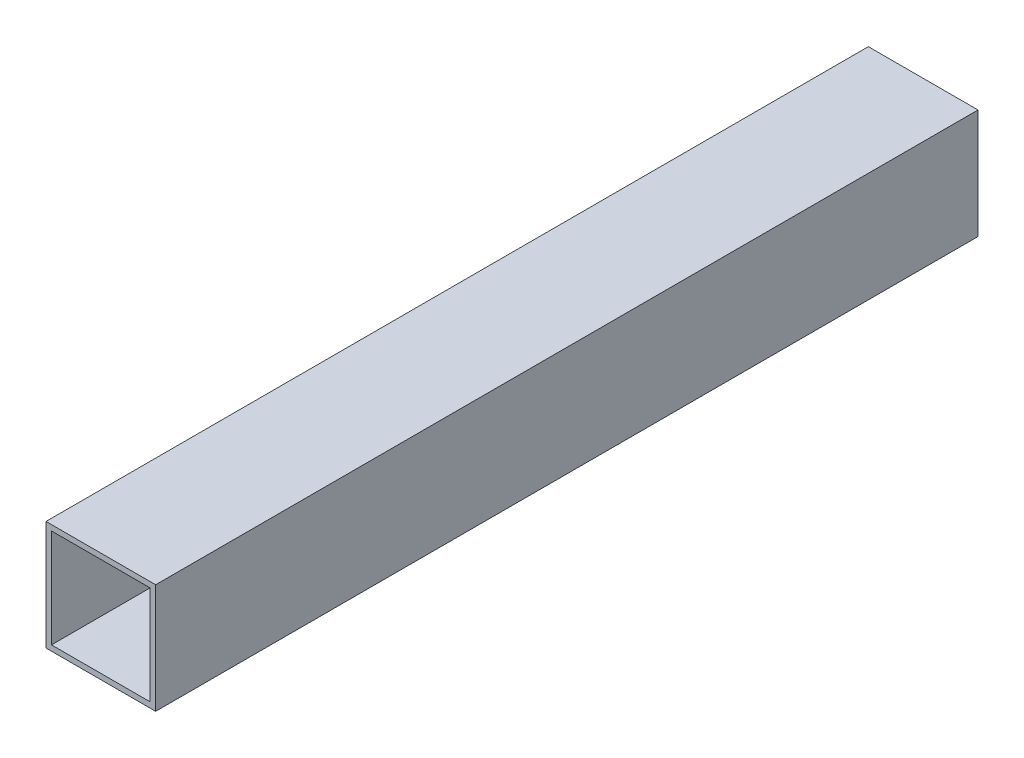
from build123d import *

# Parameters (mm, degrees)
SKETCH_1_W      = 20
SKETCH_1_H      = 20
SKETCH_1_W_2    = 18
SKETCH_1_H_2    = 18
EXTRUDE_1_DEPTH = 150


with BuildPart() as part:
    # 草图1 → 凸台-拉伸1 (new body)
    with BuildSketch(Plane.XY):
        with Locations((2.5, 2.5)):
            Rectangle(SKETCH_1_W, SKETCH_1_H)
        with Locations((2.5, 2.5)):
            Rectangle(SKETCH_1_W_2, SKETCH_1_H_2, mode=Mode.SUBTRACT)
    extrude(amount=EXTRUDE_1_DEPTH)


solid = part.part
